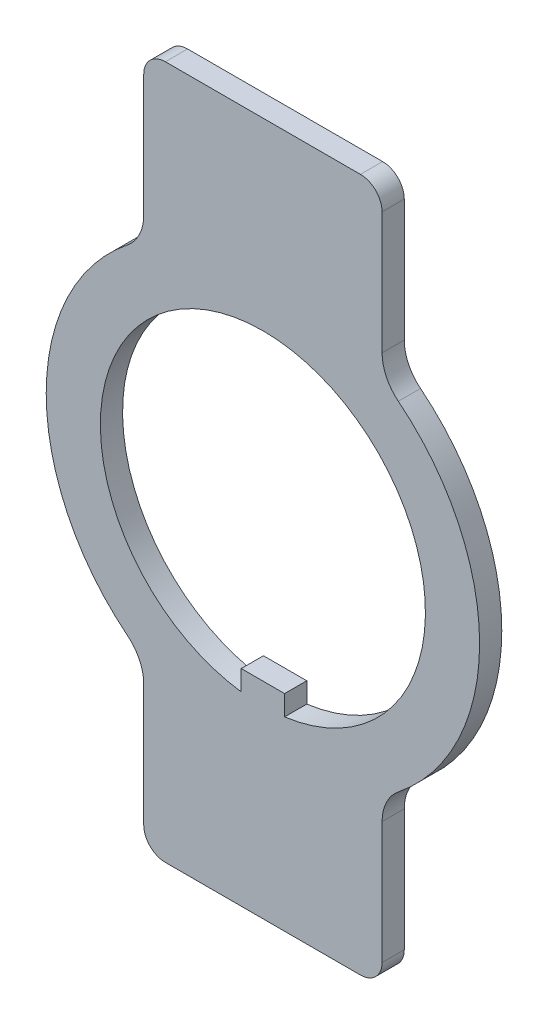
from build123d import *

# Parameters (mm, degrees)
BOSS_EXTRUDE1_DEPTH = 0.8128
FILLET1_R           = 0.79375
FILLET2_R           = 1.5875


with BuildPart() as part:
    # Sketch1 → Boss-Extrude1 (new body)
    with BuildSketch(Plane.XY):
        with BuildLine():
            Line((-4.365625, 12.7), (4.365625, 12.7))
            Line((4.365625, 12.7), (4.365625, 6.629119444))
            ThreePointArc((4.365625, 6.629119444), (7.9375, 0), (4.365625, -6.629119444))
            Line((4.365625, -6.629119444), (4.365625, -12.7))
            Line((4.365625, -12.7), (-4.365625, -12.7))
            Line((-4.365625, -12.7), (-4.365625, -6.629119444))
            ThreePointArc((-4.365625, -6.629119444), (-7.9375, 0), (-4.365625, 6.629119444))
            Line((-4.365625, 6.629119444), (-4.365625, 12.7))
        make_face()
        with BuildLine():
            Line((-0.79375, -5.899971034), (-0.79375, -5.159375))
            Line((-0.79375, -5.159375), (0.79375, -5.159375))
            Line((0.79375, -5.159375), (0.79375, -5.899971034))
            ThreePointArc((0.79375, -5.899971034), (0, 5.953125), (-0.79375, -5.899971034))
        make_face(mode=Mode.SUBTRACT)
    extrude(amount=BOSS_EXTRUDE1_DEPTH)

    # Fillet1
    fillet1_edges = [part.edges().sort_by_distance(p)[0] for p in [
        (-4.365625, 12.7, 0.4064),
        (4.365625, 12.7, 0.4064),
        (4.365625, -12.7, 0.4064),
        (-4.365625, -12.7, 0.4064),
    ]]
    fillet(fillet1_edges, radius=FILLET1_R)

    # Fillet2
    fillet2_edges = [part.edges().sort_by_distance(p)[0] for p in [
        (4.365625, 6.629119444, 0.4064),
        (4.365625, -6.629119444, 0.4064),
        (-4.365625, -6.629119444, 0.4064),
        (-4.365625, 6.629119444, 0.4064),
    ]]
    fillet(fillet2_edges, radius=FILLET2_R)


solid = part.part
